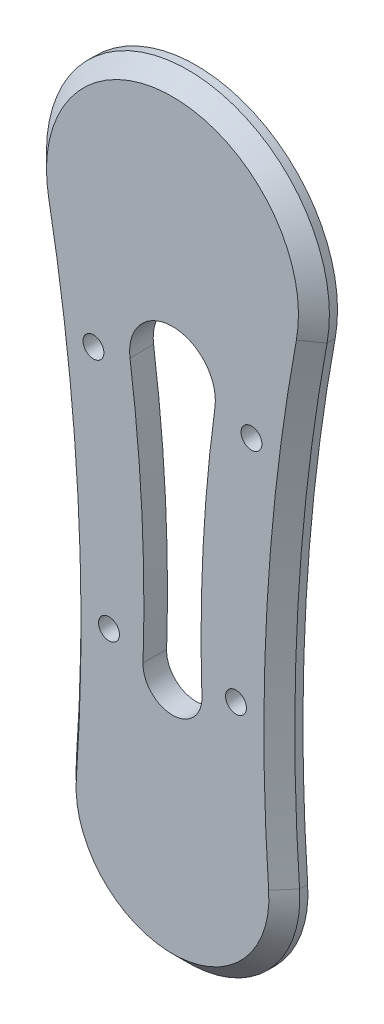
from build123d import *

# Parameters (mm, degrees)
BOSS_EXTRUDE1_DEPTH      = 7
BOSS_EXTRUDE1_DEPTH_BACK = 5
SKETCH2_R                = 2.7
BOSS_EXTRUDE3_DEPTH      = 0.1
BOSS_EXTRUDE3_DEPTH_BACK = 6
CHAMFER1_SIZE            = 4
SKETCH5_R                = 2.7
BOSS_EXTRUDE4_DEPTH      = 6
CUT_EXTRUDE1_DEPTH       = 23
SKETCH7_R                = 2.7
CUT_EXTRUDE2_DEPTH       = 37
SKETCH8_R                = 6.25
BOSS_EXTRUDE5_DEPTH      = 2.5
SKETCH9_R                = 2.7
BOSS_EXTRUDE6_DEPTH      = 4.5


with BuildPart() as part:
    # Sketch2 → Boss-Extrude1 (new, two sides: drawn at the far end of the back side and taken through both)
    with BuildSketch(Plane.XY.offset(12.572663867).offset(-BOSS_EXTRUDE1_DEPTH_BACK)):
        with Locations((-19.5, 0)):
            Circle(SKETCH2_R)
    extrude(amount=BOSS_EXTRUDE1_DEPTH + BOSS_EXTRUDE1_DEPTH_BACK)

    # Sketch4 → Boss-Extrude3 (add, two sides: drawn at the far end of the back side and taken through both)
    with BuildSketch(Plane.XY.offset(19.572663867).offset(-BOSS_EXTRUDE3_DEPTH_BACK)):
        with BuildLine():
            ThreePointArc((16.476844134, -6.650636784), (-19.499999999, 36.586394787), (-55.476844134, -6.650636782))
            ThreePointArc((-55.476844134, -6.650636782), (-47.943109392, -69.328026103), (-48.367101444, -132.455140104))
            ThreePointArc((-48.367101444, -132.455140104), (-19.500000007, -163.413605213), (9.36710143, -132.455140104))
            ThreePointArc((9.36710143, -132.455140104), (8.943109385, -69.328026104), (16.476844134, -6.650636784))
        make_face()
    extrude(amount=BOSS_EXTRUDE3_DEPTH + BOSS_EXTRUDE3_DEPTH_BACK)

    # Chamfer1
    chamfer1_edges = [part.edges().sort_by_distance(p)[0] for p in [
        (-47.943109392, -69.328026103, 19.672663867),
        (-19.500000007, -163.413605213, 19.672663867),
        (8.943109385, -69.328026104, 19.672663867),
        (-19.499999999, 36.586394787, 19.672663867),
    ]]
    chamfer(chamfer1_edges, length=CHAMFER1_SIZE)

    # Sketch5 → Boss-Extrude4 (add)
    with BuildSketch(Plane(origin=(0, 0, 13.572663867), x_dir=(-1, 0, 0), z_dir=(0, 0, -1))):
        with Locations(Location((19.500000007, -134.475863937, 0), (0, 0, 180))):
            Circle(SKETCH5_R)
    extrude(amount=BOSS_EXTRUDE4_DEPTH)

    # Sketch6 → Cut-Extrude1 (cut)
    with BuildSketch(Plane(origin=(0, 0, 13.572663867), x_dir=(-1, 0, 0), z_dir=(0, 0, -1))):
        with BuildLine():
            ThreePointArc((30.487725375, -31.464034345), (19.500000001, -18.885340351), (8.512274628, -31.464034345))
            ThreePointArc((8.512274628, -31.464034345), (11.603309463, -64.698470815), (11.890013879, -98.075110316))
            ThreePointArc((11.890013879, -98.075110316), (19.500000005, -105.944284009), (27.109986131, -98.075110316))
            ThreePointArc((27.109986131, -98.075110316), (27.396690544, -64.698470815), (30.487725375, -31.464034345))
        make_face()
    extrude(amount=-CUT_EXTRUDE1_DEPTH, mode=Mode.SUBTRACT)

    # Sketch7 → Cut-Extrude2 (cut)
    with BuildSketch(Plane(origin=(0, 0, 13.572663867), x_dir=(-1, 0, 0), z_dir=(0, 0, -1))):
        with Locations((39.934899894, -33.677713254)):
            Circle(SKETCH7_R)
        with Locations((35.920760732, -94.813426318)):
            Circle(SKETCH7_R)
        with Locations((-0.934899891, -33.677713254)):
            Circle(SKETCH7_R)
        with Locations((3.079239271, -94.813426318)):
            Circle(SKETCH7_R)
    extrude(amount=-CUT_EXTRUDE2_DEPTH, mode=Mode.SUBTRACT)

    # Sketch8 → Boss-Extrude5 (add)
    with BuildSketch(Plane(origin=(0, 0, 13.572663867), x_dir=(-1, 0, 0), z_dir=(0, 0, -1))):
        with Locations(Location((19.500000007, -134.475863937, 0), (0, 0, 180))):
            Circle(SKETCH8_R)
    extrude(amount=BOSS_EXTRUDE5_DEPTH)

    # Sketch9 → Boss-Extrude6 (add)
    with BuildSketch(Plane(origin=(0, 0, 7.572663867), x_dir=(-1, 0, 0), z_dir=(0, 0, -1))):
        with Locations(Location((19.500000007, -134.475863937, 0), (0, 0, 180))):
            Circle(SKETCH9_R)
    extrude(amount=BOSS_EXTRUDE6_DEPTH)


solid = part.part
